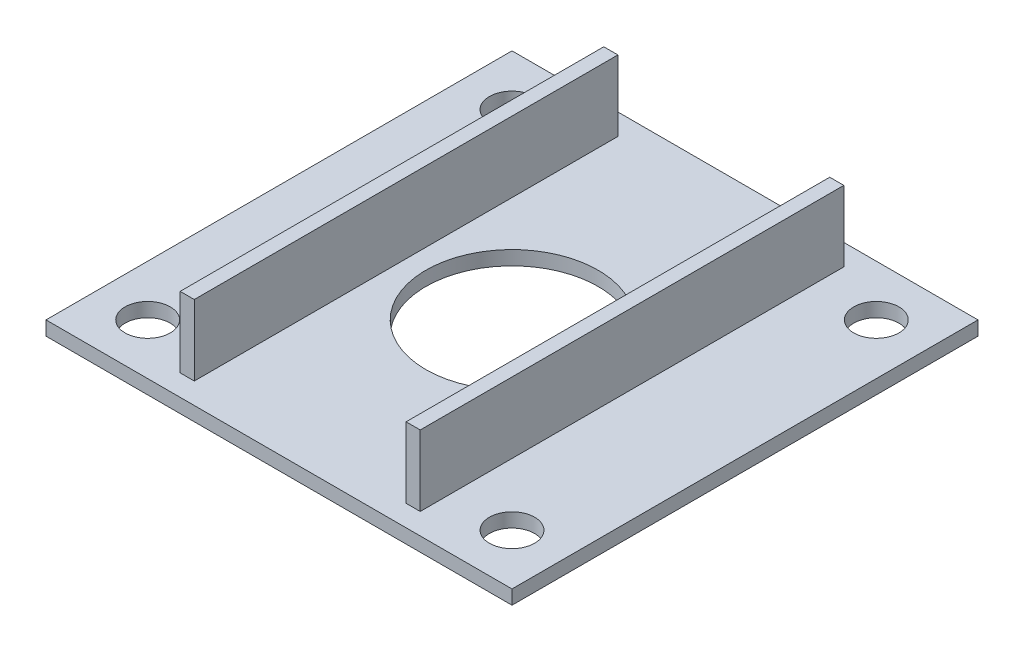
from build123d import *

# Parameters (mm, degrees)
SKETCH_1_W          = 33
SKETCH_1_H          = 33
EXTRUDE_1_DEPTH     = 1
SKETCH_2_R          = 6.1
SKETCH_2_R_2        = 1.6
CUT_EXTRUDE_1_DEPTH = 24.355941428
SKETCH_3_W          = 1
SKETCH_3_H          = 30
EXTRUDE_2_DEPTH     = 5


with BuildPart() as part:
    # 草图1 → 凸台-拉伸1 (new body)
    with BuildSketch(Plane(origin=(0, 0, 0), x_dir=(1, 0, 0), z_dir=(0, 1, 0))):
        Rectangle(SKETCH_1_W, SKETCH_1_H)
    extrude(amount=EXTRUDE_1_DEPTH)

    # 草图2 → 切除-拉伸1 (cut, through all)
    with BuildSketch(Plane(origin=(0, 1, 0), x_dir=(1, 0, 0), z_dir=(0, 1, 0))):
        with Locations(Location((0, 0, 0), (0, 0, 270))):
            Circle(SKETCH_2_R)
        with Locations(Location((-12.9, 12.9, 0), (0, 0, 270))):
            Circle(SKETCH_2_R_2)
        with Locations(Location((12.9, 12.9, 0), (0, 0, 90))):
            Circle(SKETCH_2_R_2)
        with Locations(Location((12.9, -12.9, 0), (0, 0, 270))):
            Circle(SKETCH_2_R_2)
        with Locations(Location((-12.9, -12.9, 0), (0, 0, 90))):
            Circle(SKETCH_2_R_2)
    extrude(amount=-CUT_EXTRUDE_1_DEPTH, mode=Mode.SUBTRACT)

    # 草图3 → 凸台-拉伸2 (add)
    with BuildSketch(Plane(origin=(0, 1, 0), x_dir=(1, 0, 0), z_dir=(0, 1, 0))):
        with Locations((-8, 0)):
            Rectangle(SKETCH_3_W, SKETCH_3_H)
        with Locations((8, 0)):
            Rectangle(SKETCH_3_W, SKETCH_3_H)
    extrude(amount=EXTRUDE_2_DEPTH)


solid = part.part
